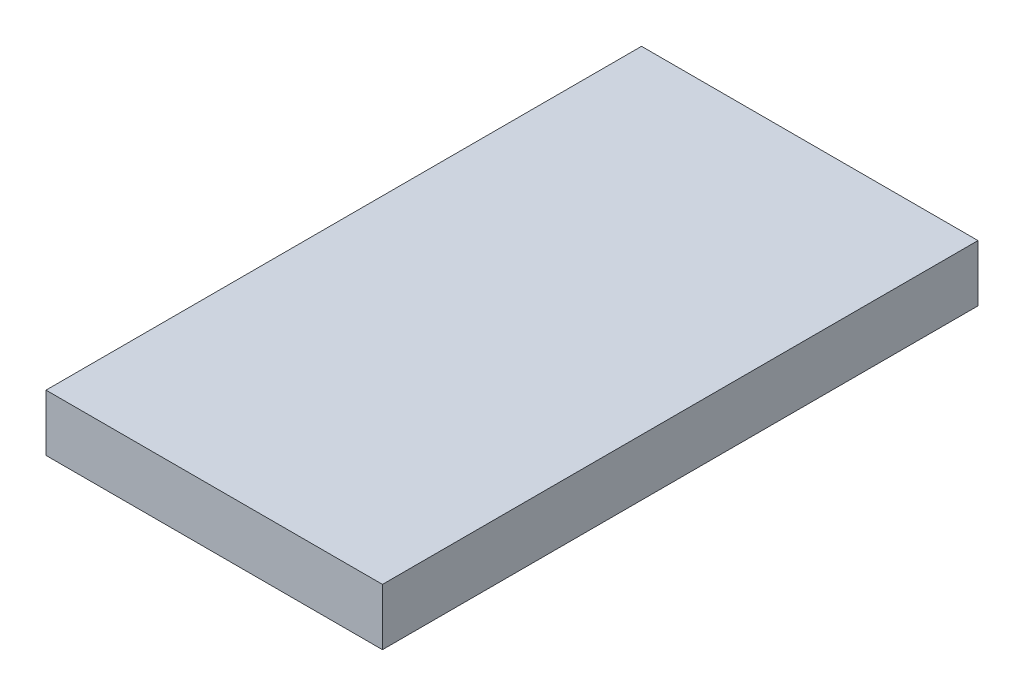
from build123d import *

# Parameters (mm, degrees)
ESQUISSE1_W        = 56.5
ESQUISSE1_H        = 9.5
BOSS_EXTRU_1_DEPTH = 100


with BuildPart() as part:
    # Esquisse1 → Boss.-Extru.1 (new body)
    with BuildSketch(Plane.XY):
        with Locations((5.206862745, 26.048039216)):
            Rectangle(ESQUISSE1_W, ESQUISSE1_H)
    extrude(amount=BOSS_EXTRU_1_DEPTH)


solid = part.part
